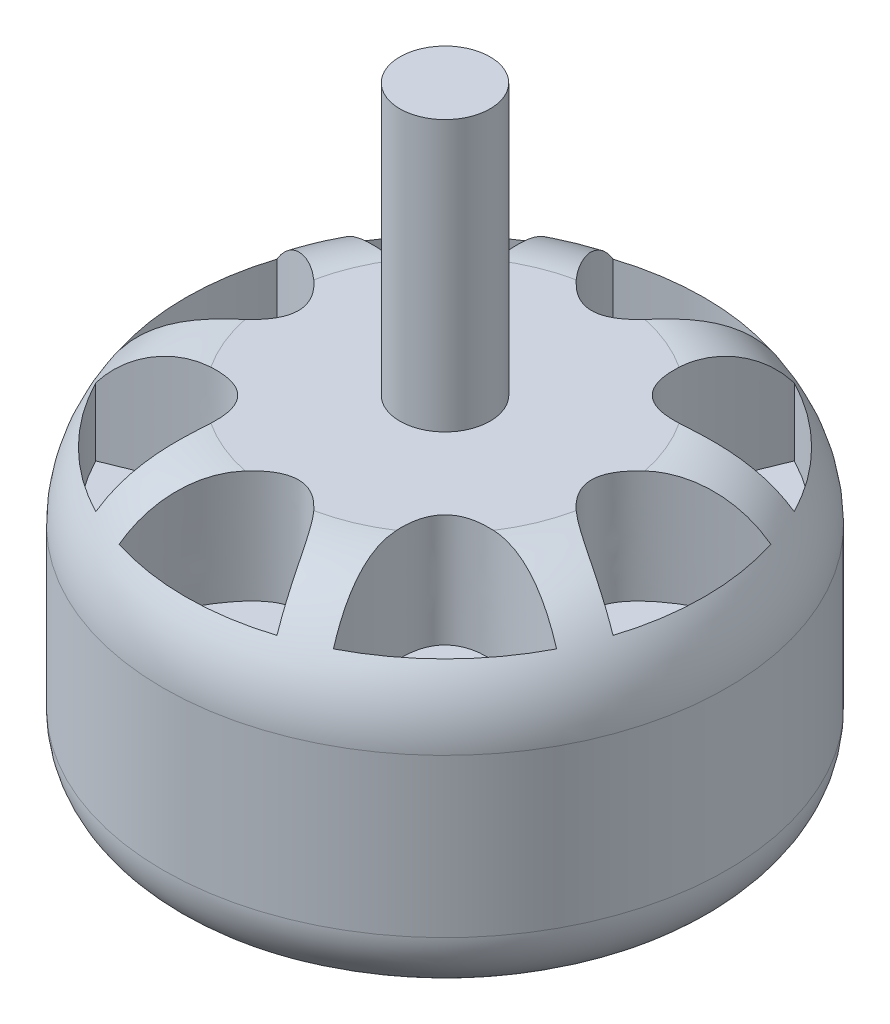
from build123d import *

# Parameters (mm, degrees)
SKETCH1_R           = 12.5
BOSS_EXTRUDE1_DEPTH = 15
SKETCH2_R           = 2
BOSS_EXTRUDE2_DEPTH = 12
FILLET1_R           = 5
FILLET2_R           = 3
CUT_EXTRUDE1_DEPTH  = 5


with BuildPart() as part:
    # Sketch1 → Boss-Extrude1 (new body)
    with BuildSketch(Plane(origin=(0, 0, 0), x_dir=(1, 0, 0), z_dir=(0, 1, 0))):
        with Locations(Location((0, 0, 0), (0, 0, 270))):
            Circle(SKETCH1_R)
    extrude(amount=BOSS_EXTRUDE1_DEPTH)

    # Sketch2 → Boss-Extrude2 (add)
    with BuildSketch(Plane(origin=(0, 15, 0), x_dir=(1, 0, 0), z_dir=(0, 1, 0))):
        with Locations(Location((0, 0, 0), (0, 0, 270))):
            Circle(SKETCH2_R)
    extrude(amount=BOSS_EXTRUDE2_DEPTH)

    # Fillet1
    fillet1_edges = [part.edges().sort_by_distance(p)[0] for p in [
        (0, 15, -12.5),
    ]]
    fillet(fillet1_edges, radius=FILLET1_R)

    # Fillet2
    fillet2_edges = [part.edges().sort_by_distance(p)[0] for p in [
        (0, 0, -12.5),
    ]]
    fillet(fillet2_edges, radius=FILLET2_R)

    # Sketch3 → Cut-Extrude1 (cut)
    with BuildSketch(Plane(origin=(0, 15, 0), x_dir=(1, 0, 0), z_dir=(0, 1, 0))):
        with BuildLine():
            ThreePointArc((3.5, 10.95445115), (0, 11.5), (-3.5, 10.95445115))
            add(Edge.make_bspline(
                [(-3.5, 10.95445115), (0, 2.04554885), (3.5, 10.95445115)],
                knots=[0, 0, 0, 1, 1, 1], degree=2))
        make_face()
        with BuildLine():
            ThreePointArc((10.220840427, 5.271092958), (8.131727984, 8.131727984), (5.271092958, 10.220840427))
            add(Edge.make_bspline(
                [(5.271092958, 10.220840427), (1.446421463, 1.446421463), (10.220840427, 5.271092958)],
                knots=[0, 0, 0, 1, 1, 1], degree=2))
        make_face()
        with BuildLine():
            ThreePointArc((10.95445115, -3.5), (11.5, 0), (10.95445115, 3.5))
            add(Edge.make_bspline(
                [(10.95445115, 3.5), (2.04554885, 0), (10.95445115, -3.5)],
                knots=[0, 0, 0, 1, 1, 1], degree=2))
        make_face()
        with BuildLine():
            ThreePointArc((5.271092958, -10.220840427), (8.131727984, -8.131727984), (10.220840427, -5.271092958))
            add(Edge.make_bspline(
                [(10.220840427, -5.271092958), (1.446421463, -1.446421463), (5.271092958, -10.220840427)],
                knots=[0, 0, 0, 1, 1, 1], degree=2))
        make_face()
        with BuildLine():
            ThreePointArc((-3.5, -10.95445115), (0, -11.5), (3.5, -10.95445115))
            add(Edge.make_bspline(
                [(3.5, -10.95445115), (0, -2.04554885), (-3.5, -10.95445115)],
                knots=[0, 0, 0, 1, 1, 1], degree=2))
        make_face()
        with BuildLine():
            ThreePointArc((-10.220840427, -5.271092958), (-8.131727984, -8.131727984), (-5.271092958, -10.220840427))
            add(Edge.make_bspline(
                [(-5.271092958, -10.220840427), (-1.446421463, -1.446421463), (-10.220840427, -5.271092958)],
                knots=[0, 0, 0, 1, 1, 1], degree=2))
        make_face()
        with BuildLine():
            ThreePointArc((-10.95445115, 3.5), (-11.5, 0), (-10.95445115, -3.5))
            add(Edge.make_bspline(
                [(-10.95445115, -3.5), (-2.04554885, 0), (-10.95445115, 3.5)],
                knots=[0, 0, 0, 1, 1, 1], degree=2))
        make_face()
        with BuildLine():
            ThreePointArc((-5.271092958, 10.220840427), (-8.131727984, 8.131727984), (-10.220840427, 5.271092958))
            add(Edge.make_bspline(
                [(-10.220840427, 5.271092958), (-1.446421463, 1.446421463), (-5.271092958, 10.220840427)],
                knots=[0, 0, 0, 1, 1, 1], degree=2))
        make_face()
    extrude(amount=-CUT_EXTRUDE1_DEPTH, mode=Mode.SUBTRACT)


solid = part.part
